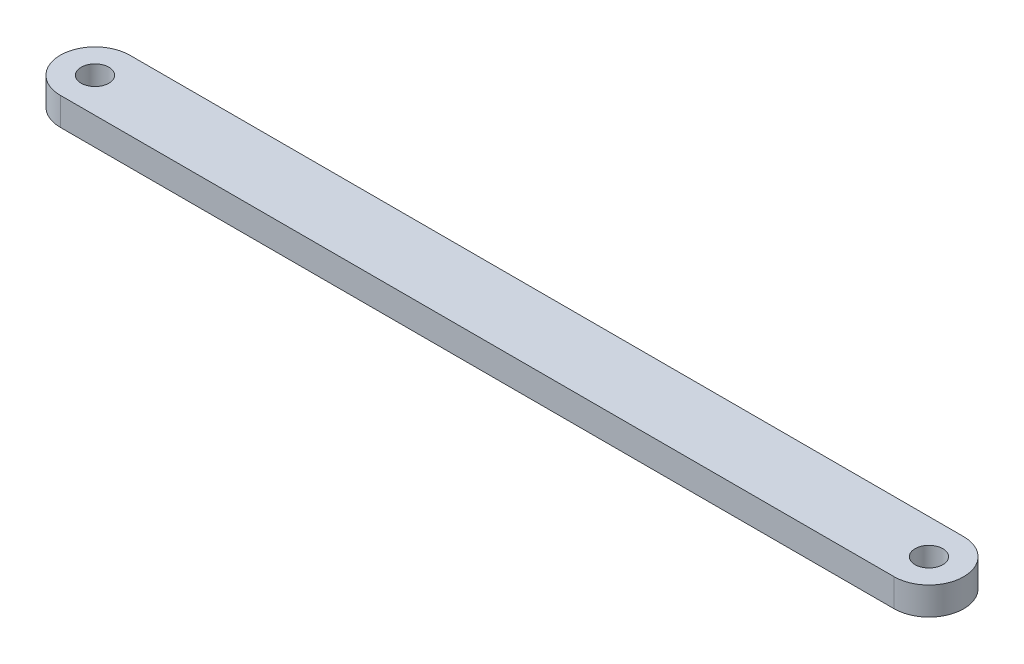
from build123d import *

# Parameters (mm, degrees)
SKETCH1_R           = 1
BOSS_EXTRUDE1_DEPTH = 2


with BuildPart() as part:
    # Sketch1 → Boss-Extrude1 (new body)
    with BuildSketch(Plane(origin=(0, 0, 0), x_dir=(1, 0, 0), z_dir=(0, 1, 0))):
        with BuildLine():
            Line((0, 2.5), (60, 2.5))
            ThreePointArc((60, 2.5), (62.5, 0), (60, -2.5))
            Line((60, -2.5), (0, -2.5))
            ThreePointArc((0, -2.5), (-2.5, 0), (0, 2.5))
        make_face()
        with Locations(Location((0, 0, 0), (0, 0, 270))):
            Circle(SKETCH1_R, mode=Mode.SUBTRACT)
        with Locations(Location((60, 0, 0), (0, 0, 270))):
            Circle(SKETCH1_R, mode=Mode.SUBTRACT)
    extrude(amount=BOSS_EXTRUDE1_DEPTH)


solid = part.part
